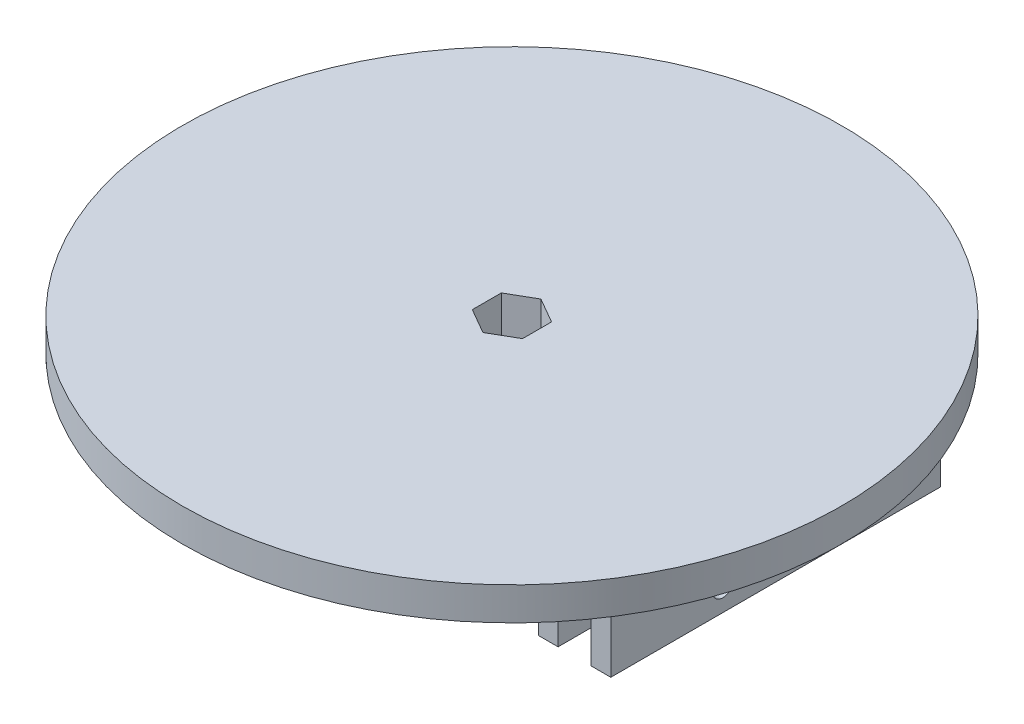
from build123d import *

# Parameters (mm, degrees)
SKETCH2_R               = 9
BOSS_EXTRUDE1_DEPTH     = 20
CUT_EXTRUDE1_DEPTH      = 20
SKETCH4_R               = 50
SKETCH4_R_2             = 4.5
BOSS_EXTRUDE3_DEPTH     = 5
CUT_EXTRUDE2_DEPTH      = 9
CUT_EXTRUDE2_DEPTH_BACK = 9
SKETCH11_R              = 1.55
CUT_EXTRUDE9_DEPTH      = 9
CUT_EXTRUDE9_DEPTH_BACK = 9
SKETCH15_R              = 1.55
SKETCH16_W              = 3
SKETCH16_H              = 50
BOSS_EXTRUDE4_DEPTH     = 10
CUT_EXTRUDE10_REACH     = 106.881
SKETCH17_R              = 1.55
CUT_EXTRUDE11_START     = -11
SKETCH18_R              = 1.55
CUT_EXTRUDE11_DEPTH     = 11
CUT_EXTRUDE14_START     = 9
SKETCH19_R              = 3.5
CUT_EXTRUDE14_DEPTH     = 3
CUT_EXTRUDE15_START     = -6
SKETCH19_3_R            = 3.5
CUT_EXTRUDE15_DEPTH     = 3
CUT_EXTRUDE16_START     = 9
SKETCH20_R              = 3.5
CUT_EXTRUDE16_DEPTH     = 3
CUT_EXTRUDE17_START     = -6
SKETCH20_2_R            = 3.5
CUT_EXTRUDE17_DEPTH     = 3


with BuildPart() as part:
    # Sketch2 → Boss-Extrude1 (new body)
    with BuildSketch(Plane(origin=(0, 0, 0), x_dir=(1, 0, 0), z_dir=(0, 1, 0))):
        with Locations(Location((0, 0, 0), (0, 0, 270))):
            Circle(SKETCH2_R)
    extrude(amount=BOSS_EXTRUDE1_DEPTH)

    # Sketch3 → Cut-Extrude1 (cut)
    with BuildSketch(Plane(origin=(0, 20, 0), x_dir=(1, 0, 0), z_dir=(0, 1, 0))):
        Polygon((0, 4.4), (-3.810511777, 2.2), (-3.810511777, -2.2), (0, -4.4), (3.810511777, -2.2), (3.810511777, 2.2), align=None)
    extrude(amount=-CUT_EXTRUDE1_DEPTH, mode=Mode.SUBTRACT)

    # Sketch4 → Boss-Extrude3 (add)
    with BuildSketch(Plane(origin=(0, 20, 0), x_dir=(1, 0, 0), z_dir=(0, 1, 0))):
        with Locations(Location((0, 0, 0), (0, 0, 270))):
            Circle(SKETCH4_R)
        Circle(SKETCH4_R_2, mode=Mode.SUBTRACT)
    extrude(amount=-BOSS_EXTRUDE3_DEPTH)

    # Sketch11 → Cut-Extrude2 (cut, two sides: drawn at the far end of the back side and taken through both)
    with BuildSketch(Plane(origin=(0, 0, 0), x_dir=(-0.8660254037844387, 0, -0.49999999999999983), z_dir=(0.49999999999999983, 0, -0.8660254037844387)).offset(-CUT_EXTRUDE2_DEPTH_BACK)):
        with Locations(Location((0, 5, 0), (0, 0, 180))):
            Circle(SKETCH11_R)
    extrude(amount=CUT_EXTRUDE2_DEPTH + CUT_EXTRUDE2_DEPTH_BACK, mode=Mode.SUBTRACT)

    # Sketch15 → Cut-Extrude9 (cut, two sides: drawn at the far end of the back side and taken through both)
    with BuildSketch(Plane(origin=(0, 0, 0), x_dir=(-0.866025403784439, 0, 0.49999999999999944), z_dir=(-0.49999999999999944, 0, -0.866025403784439)).offset(-CUT_EXTRUDE9_DEPTH_BACK)):
        with Locations(Location((0, 9, 0), (0, 0, 270))):
            Circle(SKETCH15_R)
    extrude(amount=CUT_EXTRUDE9_DEPTH + CUT_EXTRUDE9_DEPTH_BACK, mode=Mode.SUBTRACT)

    # Sketch16 → Boss-Extrude4 (add)
    with BuildSketch(Plane.XZ.offset(-15)):
        with Locations((-30.5, 0)):
            Rectangle(SKETCH16_W, SKETCH16_H)
        with Locations((-38.5, 0)):
            Rectangle(SKETCH16_W, SKETCH16_H)
        with Locations((30.5, 0)):
            Rectangle(SKETCH16_W, SKETCH16_H)
        with Locations((38.5, 0)):
            Rectangle(SKETCH16_W, SKETCH16_H)
    extrude(amount=BOSS_EXTRUDE4_DEPTH)

    # Cut-Extrude10: up to this face of the body (flat: up to its plane)
    cut_extrude10_end = Plane(part.part.faces().sort_by_distance((-29, 10, 0))[0])
    # Sketch17 → Cut-Extrude10 (cut, up to the picked face)
    with BuildSketch(Plane.ZY.offset(40), mode=Mode.PRIVATE) as cut_extrude10_sk1:
        with Locations((-16, 11.5)):
            Circle(SKETCH17_R)
    cut_extrude10_tool1 = split(extrude(cut_extrude10_sk1.sketch, amount=-CUT_EXTRUDE10_REACH, mode=Mode.PRIVATE), bisect_by=cut_extrude10_end, keep=Keep.BOTH, mode=Mode.PRIVATE)
    # Sketch17 → Cut-Extrude10 (cut, up to the picked face)
    with BuildSketch(Plane.ZY.offset(40), mode=Mode.PRIVATE) as cut_extrude10_sk2:
        with Locations((-8, 8.5)):
            Circle(SKETCH17_R)
    cut_extrude10_tool2 = split(extrude(cut_extrude10_sk2.sketch, amount=-CUT_EXTRUDE10_REACH, mode=Mode.PRIVATE), bisect_by=cut_extrude10_end, keep=Keep.BOTH, mode=Mode.PRIVATE)
    # Sketch17 → Cut-Extrude10 (cut, up to the picked face)
    with BuildSketch(Plane.ZY.offset(40), mode=Mode.PRIVATE) as cut_extrude10_sk3:
        with Locations((8, 8.5)):
            Circle(SKETCH17_R)
    cut_extrude10_tool3 = split(extrude(cut_extrude10_sk3.sketch, amount=-CUT_EXTRUDE10_REACH, mode=Mode.PRIVATE), bisect_by=cut_extrude10_end, keep=Keep.BOTH, mode=Mode.PRIVATE)
    # Sketch17 → Cut-Extrude10 (cut, up to the picked face)
    with BuildSketch(Plane.ZY.offset(40), mode=Mode.PRIVATE) as cut_extrude10_sk4:
        with Locations((16, 11.5)):
            Circle(SKETCH17_R)
    cut_extrude10_tool4 = split(extrude(cut_extrude10_sk4.sketch, amount=-CUT_EXTRUDE10_REACH, mode=Mode.PRIVATE), bisect_by=cut_extrude10_end, keep=Keep.BOTH, mode=Mode.PRIVATE)
    add(cut_extrude10_tool1.solids().sort_by(Axis((-40, 11.5, -16), (1, 0, 0)))[0], mode=Mode.SUBTRACT)
    add(cut_extrude10_tool2.solids().sort_by(Axis((-40, 8.5, -8), (1, 0, 0)))[0], mode=Mode.SUBTRACT)
    add(cut_extrude10_tool3.solids().sort_by(Axis((-40, 8.5, 8), (1, 0, 0)))[0], mode=Mode.SUBTRACT)
    add(cut_extrude10_tool4.solids().sort_by(Axis((-40, 11.5, 16), (1, 0, 0)))[0], mode=Mode.SUBTRACT)

    # Sketch18 → Cut-Extrude11 (cut)
    with BuildSketch(Plane(origin=(40, 0, 0), x_dir=(0, 0, -1), z_dir=(1, 0, 0)).offset(CUT_EXTRUDE11_START)):
        with Locations(Location((-8, 8.5, 0), (0, 0, 180))):
            Circle(SKETCH18_R)
        with Locations(Location((8, 8.5, 0), (0, 0, 180))):
            Circle(SKETCH18_R)
        with Locations(Location((16, 11.5, 0), (0, 0, 180))):
            Circle(SKETCH18_R)
        with Locations(Location((-16, 11.5, 0), (0, 0, 180))):
            Circle(SKETCH18_R)
    extrude(amount=CUT_EXTRUDE11_DEPTH, mode=Mode.SUBTRACT)

    # Sketch19 → Cut-Extrude14 (cut)
    with BuildSketch(Plane(origin=(0, 0, 0), x_dir=(-0.866025403784439, 0, 0.49999999999999944), z_dir=(-0.49999999999999944, 0, -0.866025403784439)).offset(CUT_EXTRUDE14_START)):
        with Locations((0, 9)):
            Circle(SKETCH19_R)
    extrude(amount=-CUT_EXTRUDE14_DEPTH, mode=Mode.SUBTRACT)

    # Sketch19<3> → Cut-Extrude15 (cut)
    with BuildSketch(Plane(origin=(0, 0, 0), x_dir=(-0.866025403784439, 0, 0.49999999999999944), z_dir=(-0.49999999999999944, 0, -0.866025403784439)).offset(CUT_EXTRUDE15_START)):
        with Locations((0, 9)):
            Circle(SKETCH19_3_R)
    extrude(amount=-CUT_EXTRUDE15_DEPTH, mode=Mode.SUBTRACT)

    # Sketch20 → Cut-Extrude16 (cut)
    with BuildSketch(Plane(origin=(0, 0, 0), x_dir=(-0.8660254037844387, 0, -0.49999999999999983), z_dir=(0.49999999999999983, 0, -0.8660254037844387)).offset(CUT_EXTRUDE16_START)):
        with Locations((0, 5)):
            Circle(SKETCH20_R)
    extrude(amount=-CUT_EXTRUDE16_DEPTH, mode=Mode.SUBTRACT)

    # Sketch20<2> → Cut-Extrude17 (cut)
    with BuildSketch(Plane(origin=(0, 0, 0), x_dir=(-0.8660254037844387, 0, -0.49999999999999983), z_dir=(0.49999999999999983, 0, -0.8660254037844387)).offset(CUT_EXTRUDE17_START)):
        with Locations((0, 5)):
            Circle(SKETCH20_2_R)
    extrude(amount=-CUT_EXTRUDE17_DEPTH, mode=Mode.SUBTRACT)


solid = part.part
